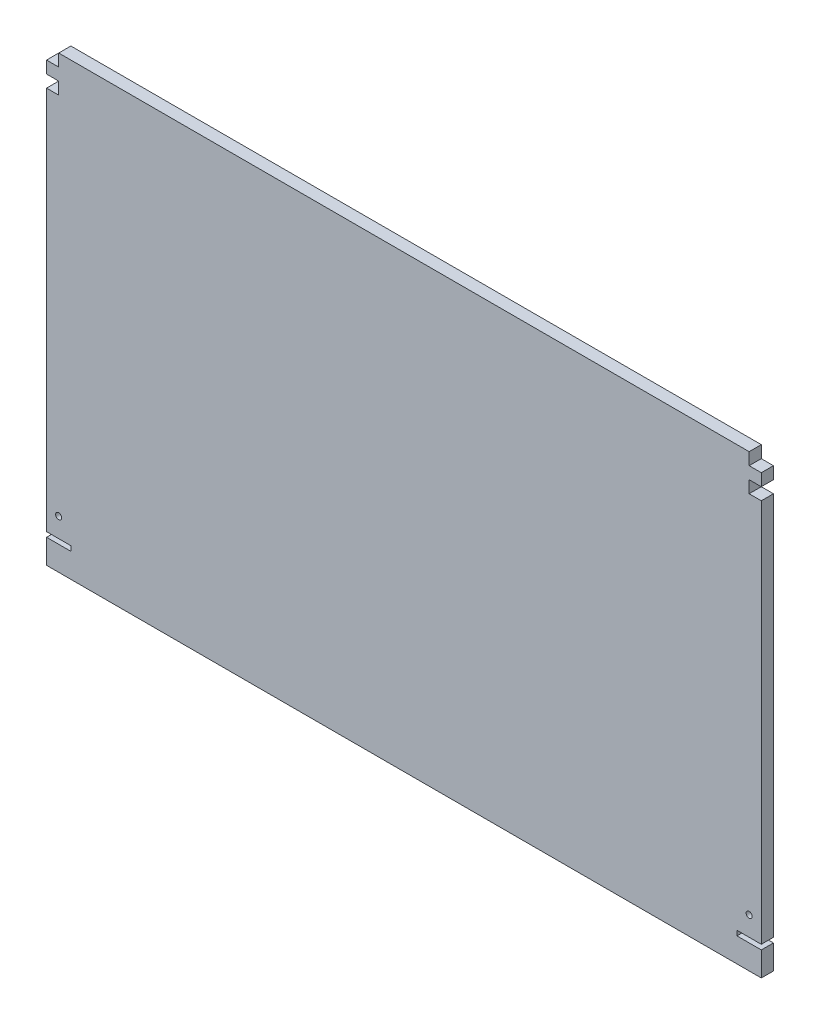
from build123d import *

# Parameters (mm, degrees)
BOSS_EXTRUDE1_DEPTH = 5
SKETCH2_W           = 10
SKETCH2_H           = 2
CUT_EXTRUDE1_DEPTH  = 5
SKETCH3_R           = 1.25
CUT_EXTRUDE2_DEPTH  = 5


with BuildPart() as part:
    # Sketch1 → Boss-Extrude1 (new body)
    with BuildSketch(Plane.XY):
        Polygon((-5, -5), (-5, 0), (-289, 0), (-289, -5), (-294, -5), (-294, -10), (-289, -10), (-289, -15), (-294, -15), (-294, -185), (0, -185), (0, -15), (-5, -15), (-5, -10), (0, -10), (0, -5), align=None)
    extrude(amount=BOSS_EXTRUDE1_DEPTH)

    # Sketch2 → Cut-Extrude1 (cut)
    with BuildSketch(Plane(origin=(0, 0, 0), x_dir=(-1, 0, 0), z_dir=(0, 0, -1))):
        with Locations((289, -174)):
            Rectangle(SKETCH2_W, SKETCH2_H)
        with Locations((5, -174)):
            Rectangle(SKETCH2_W, SKETCH2_H)
    extrude(amount=-CUT_EXTRUDE1_DEPTH, mode=Mode.SUBTRACT)

    # Sketch3 → Cut-Extrude2 (cut)
    with BuildSketch(Plane(origin=(0, 0, 0), x_dir=(-1, 0, 0), z_dir=(0, 0, -1))):
        with Locations((289, -165)):
            Circle(SKETCH3_R)
        with Locations(Location((5, -165, 0), (0, 0, 180))):
            Circle(SKETCH3_R)
    extrude(amount=-CUT_EXTRUDE2_DEPTH, mode=Mode.SUBTRACT)


solid = part.part
